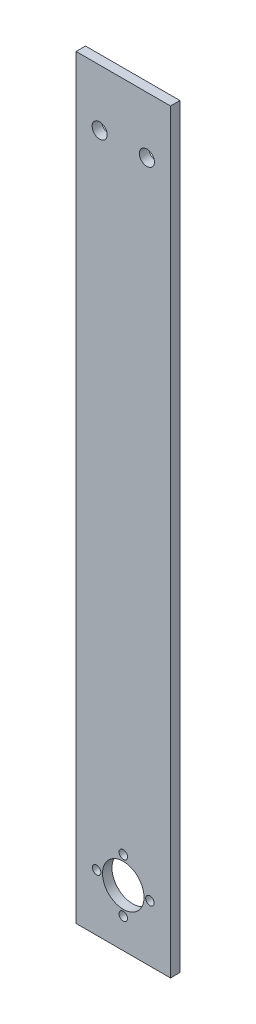
from build123d import *

# Parameters (mm, degrees)
SKETCH1_W           = 50
SKETCH1_H           = 400
SKETCH1_R           = 4
BOSS_EXTRUDE1_DEPTH = 5
SKETCH2_R           = 2.25
SKETCH2_R_2         = 11
CUT_EXTRUDE1_DEPTH  = 10


with BuildPart() as part:
    # Sketch1 → Boss-Extrude1 (new body)
    with BuildSketch(Plane.XY):
        with Locations((11.473600575, -138.26932293)):
            Rectangle(SKETCH1_W, SKETCH1_H)
        with Locations((-1.026399425, 31.73067707)):
            Circle(SKETCH1_R, mode=Mode.SUBTRACT)
        with Locations((23.973600575, 31.73067707)):
            Circle(SKETCH1_R, mode=Mode.SUBTRACT)
    extrude(amount=BOSS_EXTRUDE1_DEPTH)

    # Sketch2 → Cut-Extrude1 (cut)
    with BuildSketch(Plane(origin=(0, 0, 0), x_dir=(-1, 0, 0), z_dir=(0, 0, -1))):
        with Locations((-11.473600575, -322.39432293)):
            Circle(SKETCH2_R)
        with Locations((2.651399425, -308.26932293)):
            Circle(SKETCH2_R)
        with Locations((-11.473600575, -294.14432293)):
            Circle(SKETCH2_R)
        with Locations((-25.598600575, -308.26932293)):
            Circle(SKETCH2_R)
        with Locations((-11.473600575, -308.26932293)):
            Circle(SKETCH2_R_2)
    extrude(amount=-CUT_EXTRUDE1_DEPTH, mode=Mode.SUBTRACT)


solid = part.part
